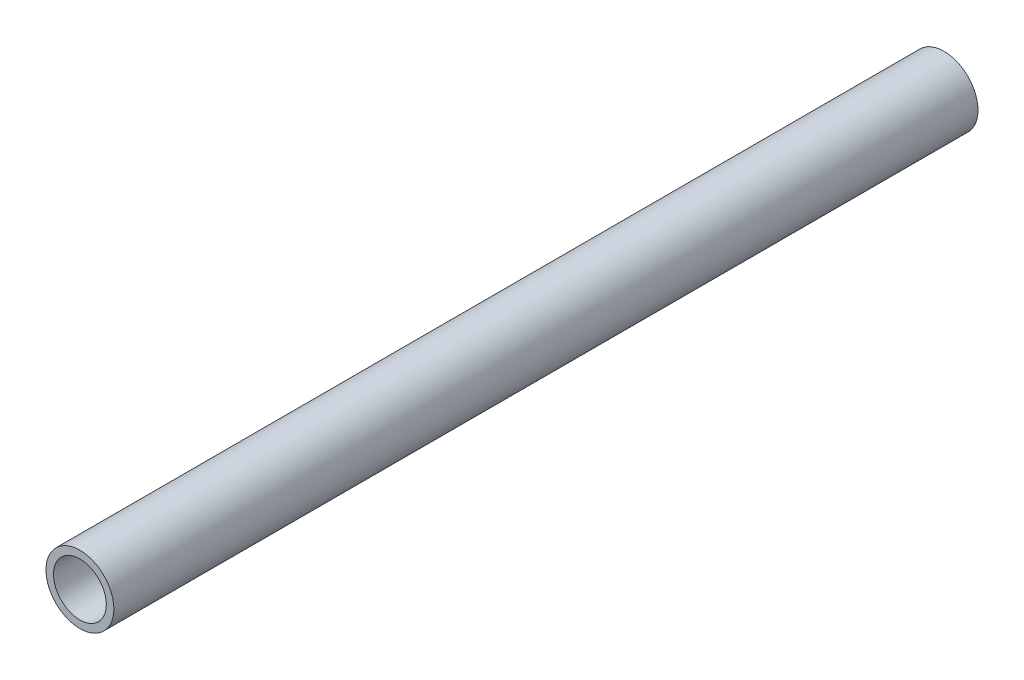
from build123d import *

# Parameters (mm, degrees)
SKETCH1_R           = 9
SKETCH1_R_2         = 7
BOSS_EXTRUDE1_DEPTH = 229.04


with BuildPart() as part:
    # Sketch1 → Boss-Extrude1 (new body)
    with BuildSketch(Plane.XY):
        Circle(SKETCH1_R)
        Circle(SKETCH1_R_2, mode=Mode.SUBTRACT)
    extrude(amount=BOSS_EXTRUDE1_DEPTH)


solid = part.part
